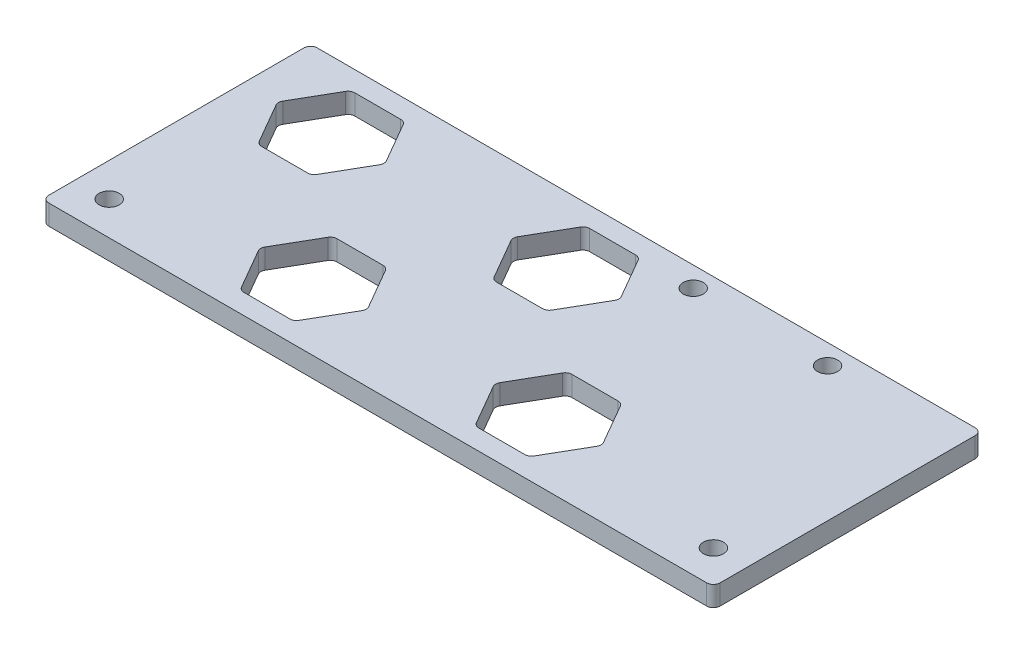
from build123d import *

# Parameters (mm, degrees)
SKETCH_1_W          = 100
SKETCH_1_H          = 40
EXTRUDE_1_DEPTH     = 3
SKETCH_2_R          = 1.5
CUT_EXTRUDE_1_DEPTH = 3
FILLET_1_R          = 1
CUT_EXTRUDE_2_DEPTH = 10
FILLET_2_R          = 1
SKETCH_4_R          = 1.5
CUT_EXTRUDE_3_DEPTH = 10


with BuildPart() as part:
    # 草图1 → 凸台-拉伸1 (new body)
    with BuildSketch(Plane(origin=(0, 0, 0), x_dir=(1, 0, 0), z_dir=(0, 1, 0))):
        Rectangle(SKETCH_1_W, SKETCH_1_H)
    extrude(amount=EXTRUDE_1_DEPTH)

    # 草图2 → 切除-拉伸1 (cut)
    with BuildSketch(Plane(origin=(0, 3, 0), x_dir=(1, 0, 0), z_dir=(0, 1, 0))):
        with Locations(Location((10, 17, 0), (0, 0, 270))):
            Circle(SKETCH_2_R)
        with Locations(Location((30, 17, 0), (0, 0, 270))):
            Circle(SKETCH_2_R)
    extrude(amount=-CUT_EXTRUDE_1_DEPTH, mode=Mode.SUBTRACT)

    # 圆角1
    fillet_1_edges = [part.edges().sort_by_distance(p)[0] for p in [
        (50, 1.5, 20),
        (-50, 1.5, 20),
        (-50, 1.5, -20),
        (50, 1.5, -20),
    ]]
    fillet(fillet_1_edges, radius=FILLET_1_R)

    # 草图3 → 切除-拉伸2 (cut)
    with BuildSketch(Plane(origin=(0, 3, 0), x_dir=(1, 0, 0), z_dir=(0, 1, 0))):
        Polygon((-29, 10.07179677), (-33, 17), (-41, 17), (-45, 10.07179677), (-41, 3.143593539), (-33, 3.143593539), align=None)
        Polygon((-11.503632276, -10.07179677), (-15.503632276, -3.143593539), (-23.503632276, -3.143593539), (-27.503632276, -10.07179677), (-23.503632276, -17), (-15.503632276, -17), align=None)
        Polygon((5.992735447, 10.07179677), (1.992735447, 17), (-6.007264553, 17), (-10.007264553, 10.07179677), (-6.007264553, 3.143593539), (1.992735447, 3.143593539), align=None)
        Polygon((23.489103171, -10.07179677), (19.489103171, -3.143593539), (11.489103171, -3.143593539), (7.489103171, -10.07179677), (11.489103171, -17), (19.489103171, -17), align=None)
    extrude(amount=-CUT_EXTRUDE_2_DEPTH, mode=Mode.SUBTRACT)

    # 圆角2
    fillet_2_edges = [part.edges().sort_by_distance(p)[0] for p in [
        (-11.503632276, 1.5, 10.07179677),
        (-15.503632276, 1.5, 17),
        (-23.503632276, 1.5, 17),
        (-27.503632276, 1.5, 10.07179677),
        (-23.503632276, 1.5, 3.143593539),
        (-15.503632276, 1.5, 3.143593539),
        (23.489103171, 1.5, 10.07179677),
        (19.489103171, 1.5, 17),
        (11.489103171, 1.5, 17),
        (7.489103171, 1.5, 10.07179677),
        (11.489103171, 1.5, 3.143593539),
        (19.489103171, 1.5, 3.143593539),
        (-29, 1.5, -10.07179677),
        (-33, 1.5, -3.143593539),
        (-41, 1.5, -3.143593539),
        (-45, 1.5, -10.07179677),
        (-41, 1.5, -17),
        (-33, 1.5, -17),
        (5.992735447, 1.5, -10.07179677),
        (1.992735447, 1.5, -3.143593539),
        (-6.007264553, 1.5, -3.143593539),
        (-10.007264553, 1.5, -10.07179677),
        (-6.007264553, 1.5, -17),
        (1.992735447, 1.5, -17),
    ]]
    fillet(fillet_2_edges, radius=FILLET_2_R)

    # 草图4 → 切除-拉伸3 (cut)
    with BuildSketch(Plane(origin=(0, 3, 0), x_dir=(1, 0, 0), z_dir=(0, 1, 0))):
        with Locations(Location((-45, -15, 0), (0, 0, 270))):
            Circle(SKETCH_4_R)
        with Locations(Location((45, -15, 0), (0, 0, 270))):
            Circle(SKETCH_4_R)
    extrude(amount=-CUT_EXTRUDE_3_DEPTH, mode=Mode.SUBTRACT)


solid = part.part
